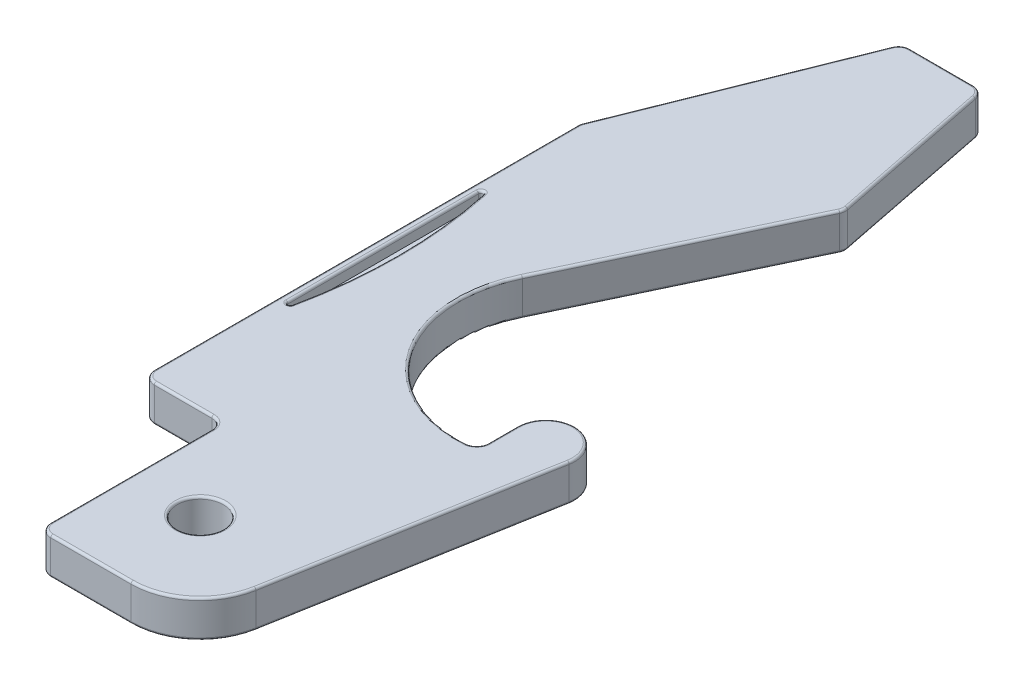
from build123d import *

# Parameters (mm, degrees)
BOSS_EXTRUDE1_DEPTH = 1.6
FILLET1_R           = 3
SKETCH2_R           = 1
SKETCH2_W           = 3.5
SKETCH2_H           = 8
CUT_EXTRUDE1_DEPTH  = 40.093412924
FILLET2_R           = 0.5
FILLET3_R           = 0.1
CUT_EXTRUDE2_DEPTH  = 0.5
FILLET4_R           = 0.1


with BuildPart() as part:
    # Sketch1 → Boss-Extrude1 (new body)
    with BuildSketch(Plane(origin=(0, 0, 0), x_dir=(1, 0, 0), z_dir=(0, 1, 0))):
        with BuildLine():
            Line((0, 0), (0, 27))
            Line((0, 27), (4, 37))
            Line((4, 37), (7.5, 37))
            Line((7.5, 37), (9, 29.5))
            Line((9, 29.5), (4.496932826, 20))
            ThreePointArc((4.496932826, 20), (5.023066748, 14.616415918), (10.019382333, 12.543585716))
            Line((10.019382333, 12.543585716), (10.019382333, 14.25))
            ThreePointArc((10.019382333, 14.25), (11.379445762, 15.495144988), (12.5, 14.030728118))
            Line((12.5, 14.030728118), (10, 0))
            Line((10, 0), (0, 0))
        make_face()
    extrude(amount=BOSS_EXTRUDE1_DEPTH)

    # Fillet1
    fillet1_edges = [part.edges().sort_by_distance(p)[0] for p in [
        (10, 0.8, 0),
    ]]
    fillet(fillet1_edges, radius=FILLET1_R)

    # Sketch2 → Cut-Extrude1 (cut, through all)
    with BuildSketch(Plane(origin=(0, 1.6, 0), x_dir=(1, 0, 0), z_dir=(0, 1, 0))):
        with Locations(Location((6.5, 4, 0), (0, 0, 270))):
            Circle(SKETCH2_R)
        with Locations((1.75, 4)):
            Rectangle(SKETCH2_W, SKETCH2_H)
    extrude(amount=-CUT_EXTRUDE1_DEPTH, mode=Mode.SUBTRACT)

    # Fillet2
    fillet2_edges = [part.edges().sort_by_distance(p)[0] for p in [
        (0, 0.8, -27),
        (4, 0.8, -37),
        (7.5, 0.8, -37),
        (9, 0.8, -29.5),
        (10.019382333, 0.8, -12.543585716),
        (0, 0.8, -8),
        (3.5, 0.8, -8),
        (3.5, 0.8, 0),
    ]]
    fillet(fillet2_edges, radius=FILLET2_R)

    # Fillet3
    fillet3_edges = [part.edges().sort_by_distance(p)[0] for p in [
        (6.712978867, 0, -24.675132875),
        (10.019382333, 0, -13.622320616),
        (11.379445762, 1.6, -15.495144988),
        (11.379445762, 0, -15.495144988),
        (10.019382333, 1.6, -13.622320616),
        (6.712978867, 1.6, -24.675132875),
        (11.470386592, 0, -8.2522378),
        (11.470386592, 1.6, -8.2522378),
        (9.413588067, 0, -0.700135052),
        (9.413588067, 1.6, -0.700135052),
        (6.5, 0, -5),
        (6.5, 1.6, -5),
        (4.886261124, 0, -14.81011231),
        (4.886261124, 1.6, -14.81011231),
        (8.273945581, 0, -33.130272095),
        (8.273945581, 1.6, -33.130272095),
        (3.5, 0, -4),
        (1.75, 0, -8),
        (0, 0, -17.701854399),
        (1.955019895, 0, -31.887549737),
        (5.714307265, 0, -37),
        (5.743645392, 0, 0),
        (3.646446609, 0, -0.146446609),
        (0.146446609, 0, -8.146446609),
        (0.009021807, 0, -26.998262559),
        (4.058202076, 0, -36.914033615),
        (7.407092501, 0, -36.886671071),
        (8.973458158, 0, -29.503271002),
        (1.75, 1.6, -8),
        (3.5, 1.6, -4),
        (5.743645392, 1.6, 0),
        (5.714307265, 1.6, -37),
        (1.955019895, 1.6, -31.887549737),
        (0, 1.6, -17.701854399),
        (3.646446609, 1.6, -0.146446609),
        (0.146446609, 1.6, -8.146446609),
        (0.009021807, 1.6, -26.998262559),
        (4.058202076, 1.6, -36.914033615),
        (7.407092501, 1.6, -36.886671071),
        (8.973458158, 1.6, -29.503271002),
        (9.88280236, 0, -12.651237848),
        (9.88280236, 1.6, -12.651237848),
        (3.353553391, 1.6, -7.853553391),
        (3.353553391, 0, -7.853553391),
    ]]
    fillet(fillet3_edges, radius=FILLET3_R)

    # Sketch3 → Cut-Extrude2 (cut)
    with BuildSketch(Plane(origin=(0, 1.6, 0), x_dir=(1, 0, 0), z_dir=(0, 1, 0))):
        with BuildLine():
            Line((0.35, 23.1), (0.35, 13.1))
            ThreePointArc((0.35, 13.1), (0.985083269, 18.1), (0.35, 23.1))
        make_face()
    extrude(amount=-CUT_EXTRUDE2_DEPTH, mode=Mode.SUBTRACT)

    # Fillet4
    fillet4_edges = [part.edges().sort_by_distance(p)[0] for p in [
        (0.35, 1.35, -23.1),
        (0.35, 1.35, -13.1),
        (0.985083269, 1.6, -18.1),
        (0.35, 1.6, -18.1),
    ]]
    fillet(fillet4_edges, radius=FILLET4_R)


solid = part.part
